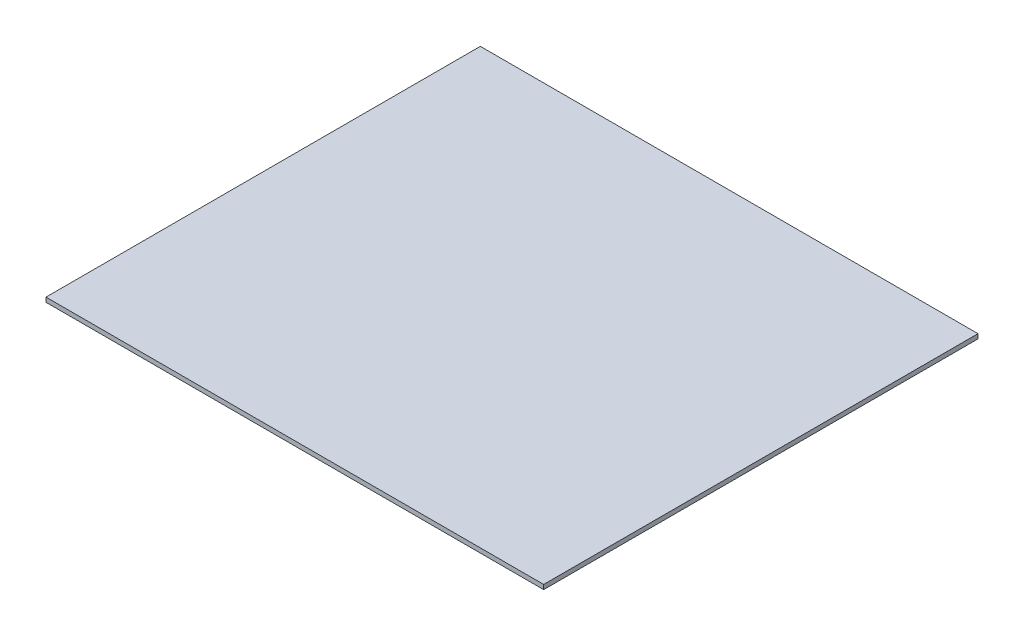
from build123d import *

# Parameters (mm, degrees)
SKETCH1_W           = 1397
SKETCH1_H           = 1219.2
BOSS_EXTRUDE1_DEPTH = 12.7


with BuildPart() as part:
    # Sketch1 → Boss-Extrude1 (new body)
    with BuildSketch(Plane(origin=(0, 0, 0), x_dir=(1, 0, 0), z_dir=(0, 1, 0))):
        Rectangle(SKETCH1_W, SKETCH1_H)
    extrude(amount=BOSS_EXTRUDE1_DEPTH)


solid = part.part
